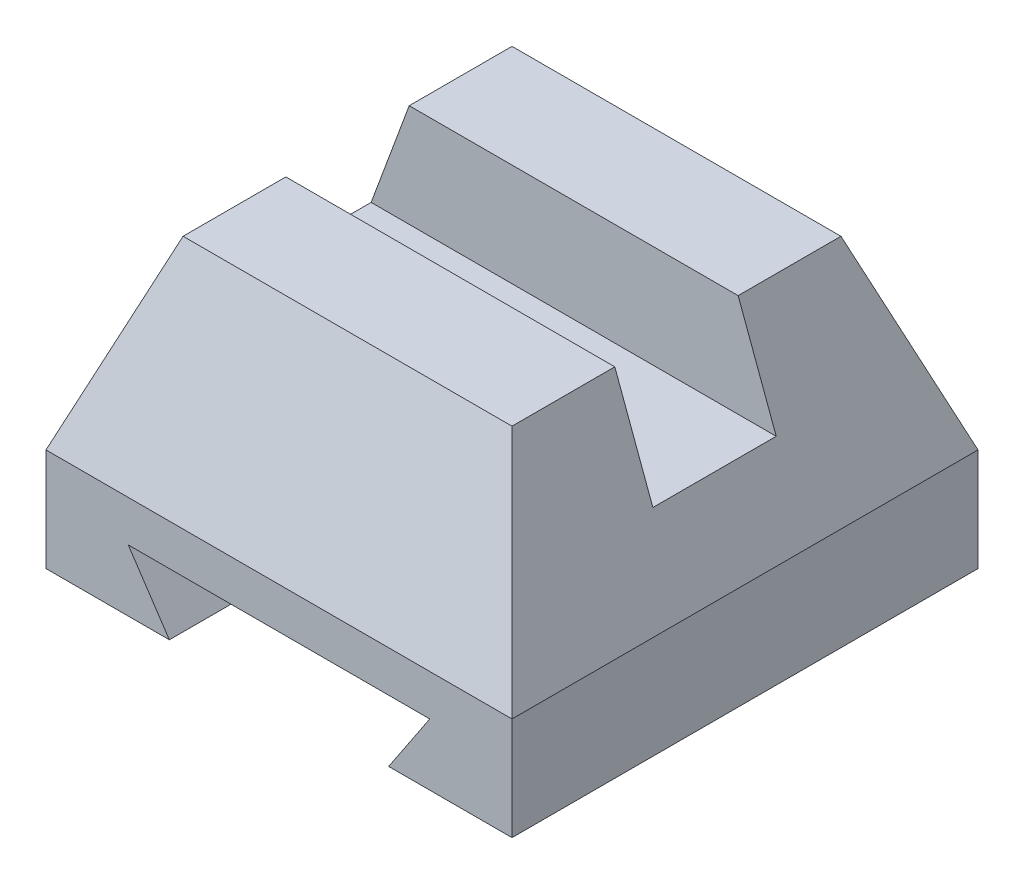
from build123d import *

# Parameters (mm, degrees)
SKETCH1_W           = 34
SKETCH1_H           = 6
BOSS_EXTRUDE2_DEPTH = 34
BOSS_EXTRUDE3_DEPTH = 34
CUT_EXTRUDE1_DEPTH  = 34
SKETCH10_W          = 9
SKETCH10_H          = 12
BOSS_EXTRUDE5_DEPTH = 34
CUT_EXTRUDE2_DEPTH  = 34


with BuildPart() as part:
    # Sketch1 → Boss-Extrude2 (new body)
    with BuildSketch(Plane.XY):
        with Locations((17, -3)):
            Rectangle(SKETCH1_W, SKETCH1_H)
    extrude(amount=BOSS_EXTRUDE2_DEPTH)

    # Sketch3 → Boss-Extrude3 (add)
    with BuildSketch(Plane.XY.offset(34)):
        Polygon((34, -6), (34, -15), (16, -15), (22, -6), align=None)
    extrude(amount=-BOSS_EXTRUDE3_DEPTH)

    # Sketch6 → section 0 of loft2
    with BuildSketch(Plane(origin=(0, 27, 0), x_dir=(1, 0, 0), z_dir=(0, 1, 0)), mode=Mode.PRIVATE) as loft2_s0:
        with BuildLine():
            Line((0, -9), (0, -24))
            Line((0, -24), (24, -24))
            Line((24, -24), (24, -9))
            Line((24, -9), (0, -9))
        make_face()
    # loft up to a face of the part (loft2)
    loft([loft2_s0.sketch, part.faces().sort_by_distance((17, 0, 17))[0]])

    # Sketch9 → Cut-Extrude1 (cut)
    with BuildSketch(Plane.ZY):
        Polygon((0, 0), (9, 0), (9, 27), align=None)
    extrude(amount=-CUT_EXTRUDE1_DEPTH, mode=Mode.SUBTRACT)

    # Sketch10 → Boss-Extrude5 (add)
    with BuildSketch(Plane.ZY):
        with Locations((4.5, 6)):
            Rectangle(SKETCH10_W, SKETCH10_H)
    extrude(amount=-BOSS_EXTRUDE5_DEPTH)

    # Sketch11 → Cut-Extrude2 (cut)
    with BuildSketch(Plane.XY.offset(9)):
        Polygon((34, 0), (34, 12), (29.555555556, 12), align=None)
    extrude(amount=-CUT_EXTRUDE2_DEPTH, mode=Mode.SUBTRACT)

    # Mirror1: part across plane


with BuildPart() as part_1:
    add(part.part)
    add(part.part.mirror(Plane(origin=(0, -6, 34), x_dir=(0, 0, 1), z_dir=(1, 0, 0))))

    # Mirror2: part across plane


with BuildPart() as part_2:
    add(part_1.part)
    add(part_1.part.mirror(Plane(origin=(0, 0, 0), x_dir=(1, 0, 0), z_dir=(0, 0, -1))))


solid = part_2.part
